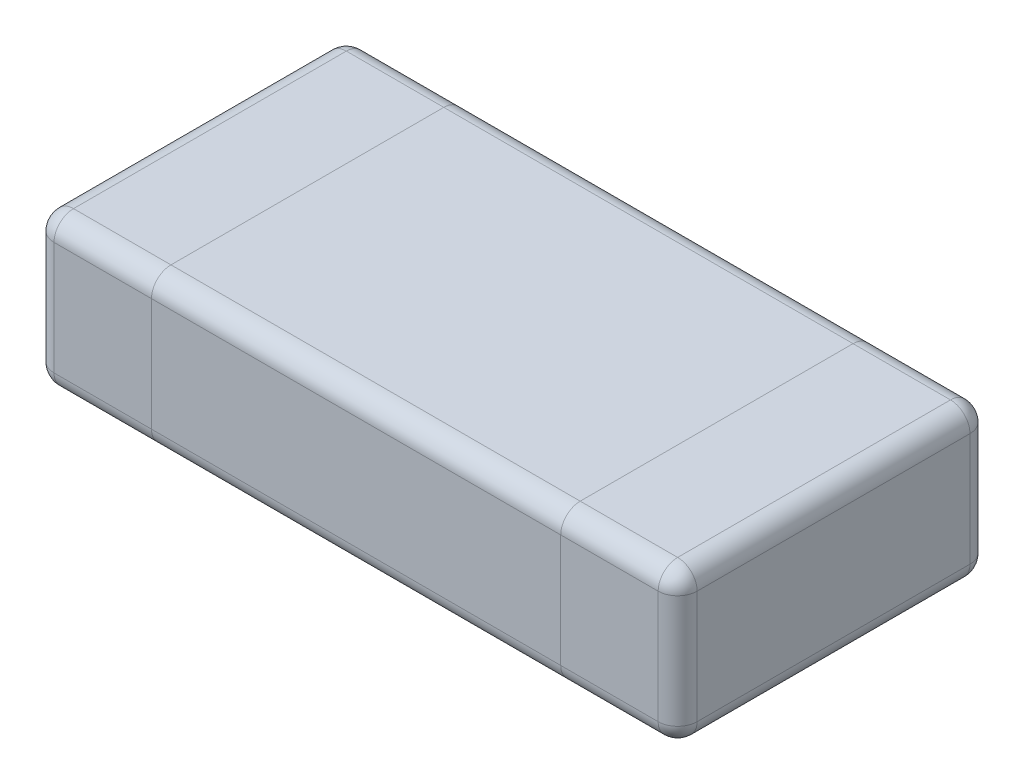
from build123d import *

# Parameters (mm, degrees)
CROQUIS1_W                = 2.1
CROQUIS1_H                = 1.6
SALIENTE_EXTRUIR1_DEPTH   = 0.78
CROQUIS3_W                = 0.6
CROQUIS3_H                = 1.6
SALIENTE_EXTRUIR3_DEPTH   = 0.78
SALIENTE_EXTRUIR3_2_DEPTH = 0.78
REDONDEO2_R               = 0.1
REDONDEO4_R               = 0.1
REDONDEO5_R               = 0.1


with BuildPart() as part:
    # Croquis1 → Saliente-Extruir1 (new body)
    with BuildSketch(Plane(origin=(0, 0, 0), x_dir=(1, 0, 0), z_dir=(0, 1, 0))):
        Rectangle(CROQUIS1_W, CROQUIS1_H)
    extrude(amount=SALIENTE_EXTRUIR1_DEPTH)

    # Redondeo2
    redondeo2_edges = [part.edges().sort_by_distance(p)[0] for p in [
        (0, 0.78, 0.8),
        (0, 0, 0.8),
        (0, 0, -0.8),
        (0, 0.78, -0.8),
    ]]
    fillet(redondeo2_edges, radius=REDONDEO2_R)


with BuildPart() as body_2:
    # Croquis3 → Saliente-Extruir3 (new body)
    with BuildSketch(Plane(origin=(0, 0, 0), x_dir=(1, 0, 0), z_dir=(0, 1, 0))):
        with Locations((1.35, 0)):
            Rectangle(CROQUIS3_W, CROQUIS3_H)
    extrude(amount=SALIENTE_EXTRUIR3_DEPTH)

    # Redondeo4
    redondeo4_edges = [body_2.edges().sort_by_distance(p)[0] for p in [
        (1.65, 0.78, 0),
        (1.35, 0.78, -0.8),
        (1.35, 0, -0.8),
        (1.65, 0, 0),
        (1.35, 0, 0.8),
        (1.65, 0.39, -0.8),
        (1.65, 0.39, 0.8),
        (1.35, 0.78, 0.8),
    ]]
    fillet(redondeo4_edges, radius=REDONDEO4_R)


with BuildPart() as body_3:
    # Croquis3 → Saliente-Extruir3 2 (new body)
    with BuildSketch(Plane(origin=(0, 0, 0), x_dir=(1, 0, 0), z_dir=(0, 1, 0))):
        with Locations((-1.35, 0)):
            Rectangle(CROQUIS3_W, CROQUIS3_H)
    extrude(amount=SALIENTE_EXTRUIR3_2_DEPTH)

    # Redondeo5
    redondeo5_edges = [body_3.edges().sort_by_distance(p)[0] for p in [
        (-1.35, 0.78, -0.8),
        (-1.65, 0.78, 0),
        (-1.35, 0.78, 0.8),
        (-1.65, 0, 0),
        (-1.35, 0, -0.8),
        (-1.35, 0, 0.8),
        (-1.65, 0.39, 0.8),
        (-1.65, 0.39, -0.8),
    ]]
    fillet(redondeo5_edges, radius=REDONDEO5_R)


solid = Compound([part.part, body_2.part, body_3.part])
